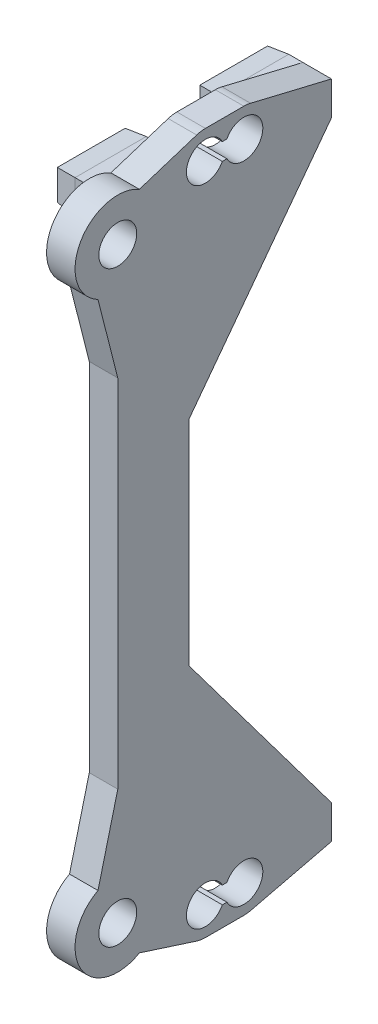
from build123d import *

# Parameters (mm, degrees)
SKETCH3_R                = 3.81
DOWELSUPPORT_DEPTH       = 1.27
SKETCH5_W                = 6.35
SKETCH5_H                = 31.75
SLIDERDOWELSUPPORT_DEPTH = 1.27
STRINGDOWELSUPPORT_DEPTH = 1.27
SKETCH9_W                = 6.35
SKETCH9_H                = 3
TABSUPPORT_DEPTH         = 1.27
INTERSUPPORT_DEPTH       = 1.27
DOWELHOLES_DEPTH         = 36.066951521
DOWELHOLES_DEPTH_BACK    = 36.066951521
SKETCH11_R               = 1.690500048
SKETCH14_W               = 6.35
SKETCH14_H               = 3
TABBASE_DEPTH            = 1.27
SKETCH15_W               = 6.35
SKETCH15_H               = 3
TABDRAFT_DEPTH           = 1.73
TABDRAFT_DRAFT           = 5
TABDRAFT_PROFILE_2_DEPTH = 1.73
TABDRAFT_PROFILE_2_DRAFT = 5


with BuildPart() as part:
    # Sketch3 → DowelSupport (new, symmetric)
    with BuildSketch(Plane(origin=(0, 0, 0), x_dir=(0, 0, -1), z_dir=(1, 0, 0))):
        with Locations((-3.175, 26.19375)):
            Circle(SKETCH3_R)
    extrude(amount=DOWELSUPPORT_DEPTH, both=True)



with BuildPart() as body_2:
    # Sketch5 → SliderDowelSupport (new, symmetric)
    with BuildSketch(Plane(origin=(0, 0, 0), x_dir=(0, 0, -1), z_dir=(1, 0, 0))):
        Rectangle(SKETCH5_W, SKETCH5_H)
    extrude(amount=SLIDERDOWELSUPPORT_DEPTH, both=True)


with BuildPart() as body_3:
    # Sketch8 → StringDowelSupport (new, symmetric)
    with BuildSketch(Plane(origin=(0, 0, 0), x_dir=(0, 0, -1), z_dir=(1, 0, 0))):
        with BuildLine():
            Line((4.6355, 31.242), (8.0645, 31.242))
            ThreePointArc((8.0645, 31.242), (10.6045, 28.702), (8.0645, 26.162))
            Line((8.0645, 26.162), (4.6355, 26.162))
            ThreePointArc((4.6355, 26.162), (2.0955, 28.702), (4.6355, 31.242))
        make_face()
    extrude(amount=STRINGDOWELSUPPORT_DEPTH, both=True)


with BuildPart() as part_1:
    add(part.part)

    add(body_3.part)  # TabSupport merges body 3
    # Sketch9 → TabSupport (add, symmetric)
    with BuildSketch(Plane(origin=(0, 0, 0), x_dir=(0, 0, -1), z_dir=(1, 0, 0))):
        with Locations((0, 27.94)):
            Rectangle(SKETCH9_W, SKETCH9_H)
        with Locations((12.7, 27.94)):
            Rectangle(SKETCH9_W, SKETCH9_H)
    extrude(amount=TABSUPPORT_DEPTH, both=True)


    add(body_2.part)  # InterSupport merges body 2
    # Sketch10 → InterSupport (add, symmetric)
    with BuildSketch(Plane(origin=(0, 0, 0), x_dir=(0, 0, -1), z_dir=(1, 0, 0))):
        Polygon((-3.175, 15.875), (-5.636846154, 25.568519231), (-3.951626852, 28.612107032), (3.858873148, 31.120357032), (8.657140431, 31.171894192), (15.875, 29.44), (15.875, 26.44), (3.175, 9.525), (3.175, 15.875), align=None)
    extrude(amount=INTERSUPPORT_DEPTH, both=True)

    # Sketch11 → DowelHoles (cut, two sides: drawn at the far end of the back side and taken through both)
    with BuildSketch(Plane(origin=(0, 0, 0), x_dir=(0, 0, -1), z_dir=(1, 0, 0)).offset(-DOWELHOLES_DEPTH_BACK)):
        with Locations((-3.175, 26.19375)):
            Circle(SKETCH11_R)
        with BuildLine():
            Line((6.144521674, 27.94), (6.555478326, 27.94))
            ThreePointArc((6.555478326, 27.94), (9.755000048, 28.702), (6.555478326, 29.464))
            Line((6.555478326, 29.464), (6.144521674, 29.464))
            ThreePointArc((6.144521674, 29.464), (2.944999952, 28.702), (6.144521674, 27.94))
        make_face()
    extrude(amount=DOWELHOLES_DEPTH + DOWELHOLES_DEPTH_BACK, mode=Mode.SUBTRACT)

    # Sketch14 → TabBase (add)
    with BuildSketch(Plane.ZY.offset(1.27)):
        with Locations((-12.7, 27.94)):
            Rectangle(SKETCH14_W, SKETCH14_H)
        with Locations((0, 27.94)):
            Rectangle(SKETCH14_W, SKETCH14_H)
    extrude(amount=TABBASE_DEPTH)


with BuildPart() as tabdraft_tool:
    # Sketch15 → TabDraft (with draft: the straight prism first)
    with BuildSketch(Plane.ZY.offset(2.54)):
        with Locations((0, 27.94)):
            Rectangle(SKETCH15_W, SKETCH15_H)
    extrude(amount=TABDRAFT_DEPTH)
    # TabDraft: the draft: its side faces are tilted about the plane it starts from
    tabdraft_sides = [tabdraft_tool.faces().sort_by_distance(p)[0] for p in [
        (-3.405, 27.94, -3.175),
        (-3.405, 26.44, 0),
        (-3.405, 27.94, 3.175),
        (-3.405, 29.44, 0),
    ]]
    draft(tabdraft_sides, Plane.ZY.offset(2.54), TABDRAFT_DRAFT)


with BuildPart() as part_2:
    add(part_1.part)

    # TabDraft: add tabdraft_tool
    add(tabdraft_tool.part)


with BuildPart() as tabdraft_profile_2_tool:
    # Sketch15 → TabDraft profile 2 (with draft: the straight prism first)
    with BuildSketch(Plane.ZY.offset(2.54)):
        with Locations((-12.7, 27.94)):
            Rectangle(SKETCH15_W, SKETCH15_H)
    extrude(amount=TABDRAFT_PROFILE_2_DEPTH)
    # TabDraft profile 2: the draft: its side faces are tilted about the plane it starts from
    tabdraft_profile_2_sides = [tabdraft_profile_2_tool.faces().sort_by_distance(p)[0] for p in [
        (-3.405, 27.94, -15.875),
        (-3.405, 26.44, -12.7),
        (-3.405, 27.94, -9.525),
        (-3.405, 29.44, -12.7),
    ]]
    draft(tabdraft_profile_2_sides, Plane.ZY.offset(2.54), TABDRAFT_PROFILE_2_DRAFT)


with BuildPart() as part_3:
    add(part_2.part)

    # TabDraft profile 2: add tabdraft_profile_2_tool
    add(tabdraft_profile_2_tool.part)

    # Mirror1: part across plane


with BuildPart() as part_4:
    add(part_3.part)
    add(part_3.part.mirror(Plane.ZX))


solid = part_4.part
